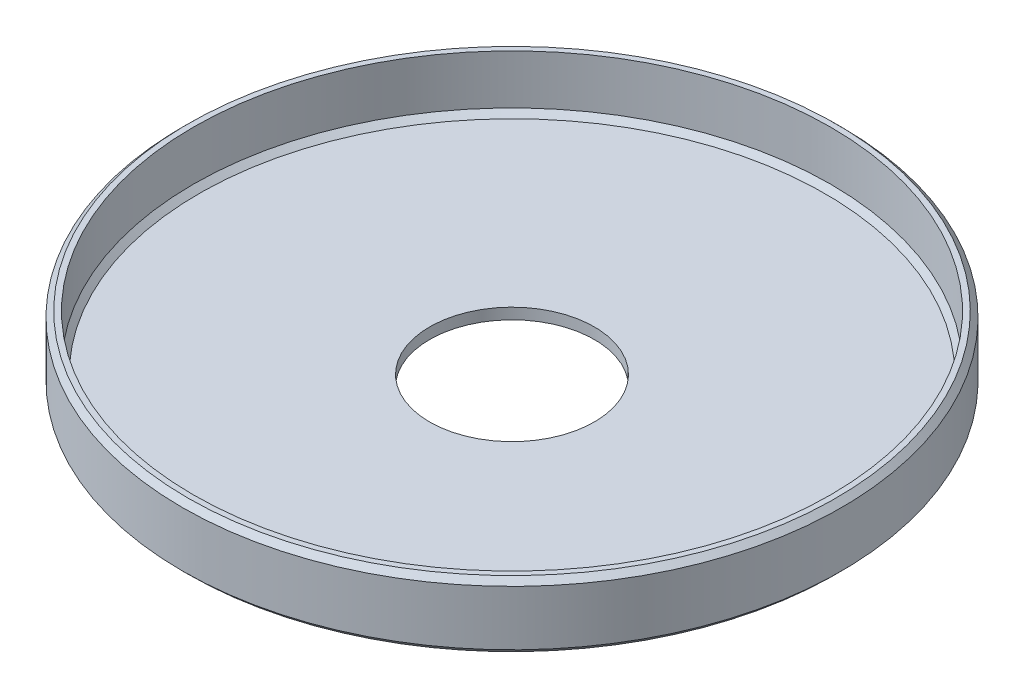
from build123d import *

# Parameters (mm, degrees)
SKICA1_R                = 60
SKICA1_R_2              = 15
P_IDAT_VYSUNUT_M1_DEPTH = 2
SKICA2_R                = 60
SKICA2_R_2              = 58
P_IDAT_VYSUNUT_M2_DEPTH = 10
ZKOSEN_1_SIZE           = 1
ZKOSEN_2_SIZE           = 1
ZKOSEN_3_SIZE           = 1


with BuildPart() as part:
    # Skica1 → Přidat vysunutím1 (new body)
    with BuildSketch(Plane(origin=(0, 0, 0), x_dir=(1, 0, 0), z_dir=(0, 1, 0))):
        with Locations(Location((0, 0, 0), (0, 0, 270))):
            Circle(SKICA1_R)
        with Locations(Location((0, 0, 0), (0, 0, 270))):
            Circle(SKICA1_R_2, mode=Mode.SUBTRACT)
    extrude(amount=P_IDAT_VYSUNUT_M1_DEPTH)

    # Skica2 → Přidat vysunutím2 (add)
    with BuildSketch(Plane(origin=(0, 2, 0), x_dir=(1, 0, 0), z_dir=(0, 1, 0))):
        with Locations(Location((0, 0, 0), (0, 0, 270))):
            Circle(SKICA2_R)
        with Locations(Location((0, 0, 0), (0, 0, 270))):
            Circle(SKICA2_R_2, mode=Mode.SUBTRACT)
    extrude(amount=P_IDAT_VYSUNUT_M2_DEPTH)

    # Zkosení1
    zkosen_1_edges = [part.edges().sort_by_distance(p)[0] for p in [
        (0, 2, -58),
    ]]
    chamfer(zkosen_1_edges, length=ZKOSEN_1_SIZE)

    # Zkosení2
    zkosen_2_edges = [part.edges().sort_by_distance(p)[0] for p in [
        (0, 0, -60),
    ]]
    chamfer(zkosen_2_edges, length=ZKOSEN_2_SIZE)

    # Zkosení3
    zkosen_3_edges = [part.edges().sort_by_distance(p)[0] for p in [
        (0, 12, -60),
    ]]
    chamfer(zkosen_3_edges, length=ZKOSEN_3_SIZE)


solid = part.part
